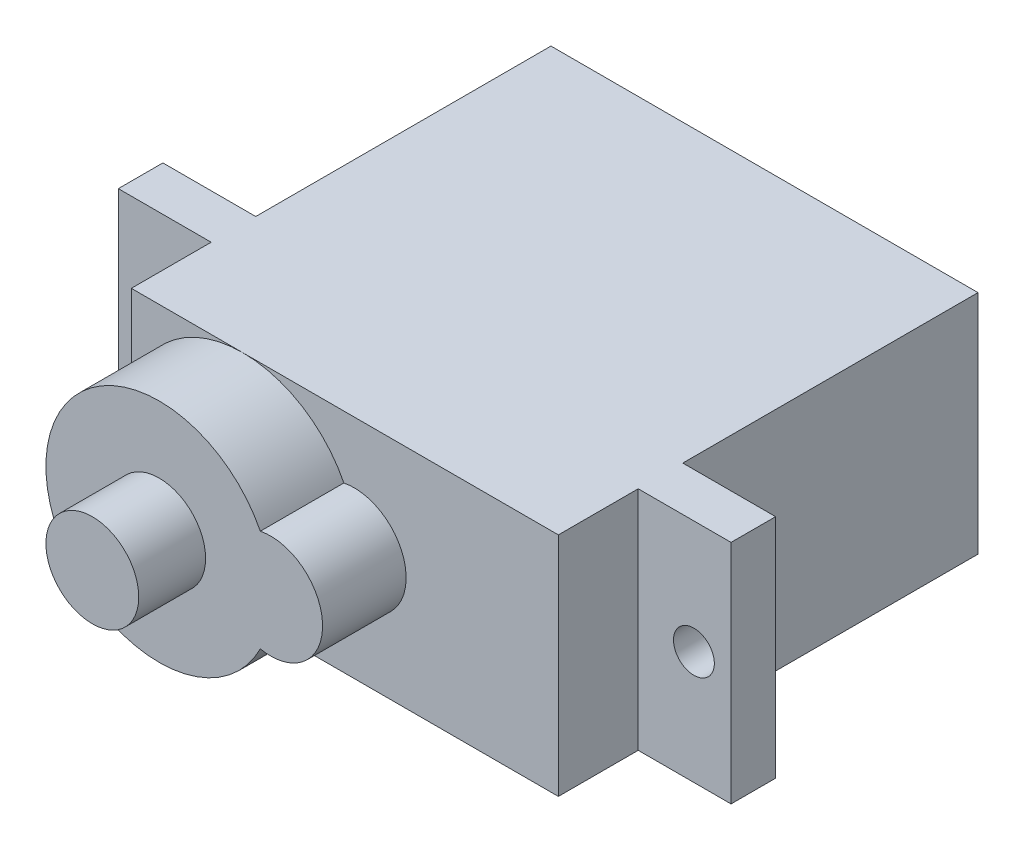
from build123d import *

# Parameters (mm, degrees)
CASE_CONSERVATIVE_PLAN_23X12P2_START     = -18.3
CASE_CONSERVATIVE_PLAN_23X12P2_PROFILE_W = 23
CASE_CONSERVATIVE_PLAN_23X12P2_PROFILE_H = 12.2
CASE_CONSERVATIVE_PLAN_23X12P2_DEPTH     = 22.6
MOUNTING_EARS_33X12P2_START              = -2.4
MOUNTING_EARS_33X12P2_PROFILE_W          = 33
MOUNTING_EARS_33X12P2_PROFILE_H          = 12.2
MOUNTING_EARS_33X12P2_DEPTH              = 2.4
RAISED_GEAR_COVER_ENVELOPE_START         = 4.3
RAISED_GEAR_COVER_ENVELOPE_PROFILE_R     = 6.1
RAISED_GEAR_COVER_ENVELOPE_DEPTH         = 4.5
SECONDARY_GEAR_COVER_ENVELOPE_START      = 4.3
SECONDARY_GEAR_COVER_ENVELOPE_PROFILE_R  = 2.8
SECONDARY_GEAR_COVER_ENVELOPE_DEPTH      = 4.5
OUTPUT_ENVELOPE_NOT_SPLINE_START         = 8.8
OUTPUT_ENVELOPE_NOT_SPLINE_PROFILE_R     = 2.5
OUTPUT_ENVELOPE_NOT_SPLINE_DEPTH         = 3.6
MOUNTING_HOLES_NOMINAL_START             = -50
MOUNTING_HOLES_NOMINAL_PROFILE_R         = 1.1
MOUNTING_HOLES_NOMINAL_DEPTH             = 80.259186592


with BuildPart() as part:
    # Case_conservative_plan_23x12p2_profile → Case_conservative_plan_23x12p2 (new body)
    with BuildSketch(Plane.XY.offset(CASE_CONSERVATIVE_PLAN_23X12P2_START)):
        with Locations((5.5, 0)):
            Rectangle(CASE_CONSERVATIVE_PLAN_23X12P2_PROFILE_W, CASE_CONSERVATIVE_PLAN_23X12P2_PROFILE_H)
    extrude(amount=CASE_CONSERVATIVE_PLAN_23X12P2_DEPTH)

    # Mounting_ears_33x12p2_profile → Mounting_ears_33x12p2 (add)
    with BuildSketch(Plane.XY.offset(MOUNTING_EARS_33X12P2_START)):
        with Locations((5.5, 0)):
            Rectangle(MOUNTING_EARS_33X12P2_PROFILE_W, MOUNTING_EARS_33X12P2_PROFILE_H)
    extrude(amount=MOUNTING_EARS_33X12P2_DEPTH)

    # Raised_gear_cover_envelope_profile → Raised_gear_cover_envelope (add)
    with BuildSketch(Plane.XY.offset(RAISED_GEAR_COVER_ENVELOPE_START)):
        with Locations(Location((0, 0, 0), (0, 0, 169.611142185))):
            Circle(RAISED_GEAR_COVER_ENVELOPE_PROFILE_R)
    extrude(amount=RAISED_GEAR_COVER_ENVELOPE_DEPTH)

    # Secondary_gear_cover_envelope_profile → Secondary_gear_cover_envelope (add)
    with BuildSketch(Plane.XY.offset(SECONDARY_GEAR_COVER_ENVELOPE_START)):
        with Locations((6, 0)):
            Circle(SECONDARY_GEAR_COVER_ENVELOPE_PROFILE_R)
    extrude(amount=SECONDARY_GEAR_COVER_ENVELOPE_DEPTH)

    # Output_envelope_not_spline_profile → Output_envelope_not_spline (add)
    with BuildSketch(Plane.XY.offset(OUTPUT_ENVELOPE_NOT_SPLINE_START)):
        Circle(OUTPUT_ENVELOPE_NOT_SPLINE_PROFILE_R)
    extrude(amount=OUTPUT_ENVELOPE_NOT_SPLINE_DEPTH)

    # Mounting_holes_nominal_profile → Mounting_holes_nominal (cut, through all)
    with BuildSketch(Plane.XY.offset(MOUNTING_HOLES_NOMINAL_START)):
        with Locations(Location((-9, 0, 0), (0, 0, 180))):
            Circle(MOUNTING_HOLES_NOMINAL_PROFILE_R)
        with Locations(Location((20, 0, 0), (0, 0, 180))):
            Circle(MOUNTING_HOLES_NOMINAL_PROFILE_R)
    extrude(amount=MOUNTING_HOLES_NOMINAL_DEPTH, mode=Mode.SUBTRACT)


solid = part.part
